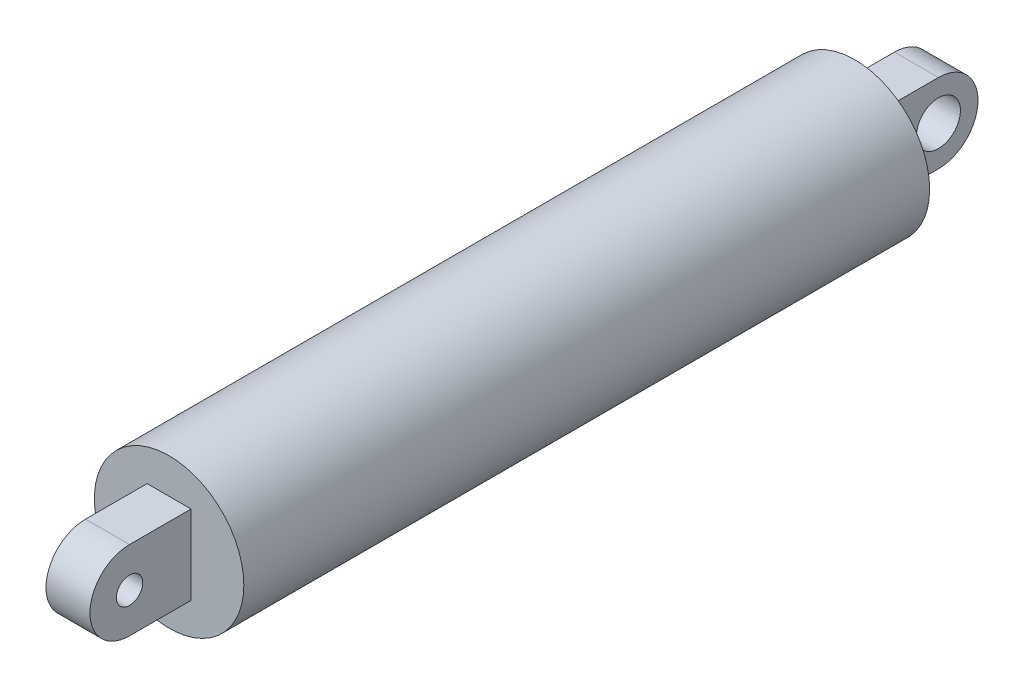
from build123d import *

# Parameters (mm, degrees)
SKETCH1_W           = 78
SKETCH1_H           = 8.5
SKETCH2_R           = 1.5
SKETCH2_R_2         = 2.5
BOSS_EXTRUDE1_DEPTH = 2.5


with BuildPart() as part:
    # Sketch1 → Revolve1 (revolve)
    with BuildSketch(Plane(origin=(0, 0, 0), x_dir=(0, 0, -1), z_dir=(1, 0, 0)), mode=Mode.PRIVATE) as revolve1_sk:
        with Locations((39, 4.25)):
            Rectangle(SKETCH1_W, SKETCH1_H)
    revolve(revolve1_sk.sketch.rotate(Axis((0, 0, 27.669458773), (0, 0, -1)), 90), axis=Axis((0, 0, 27.669458773), (0, 0, -1)))

    # Sketch2 → Boss-Extrude1 (add, symmetric)
    # profile 1 of 2: a face of its own
    with BuildSketch(Plane(origin=(0, 0, 0), x_dir=(0, 0, -1), z_dir=(1, 0, 0))):
        with BuildLine():
            Line((-7, 4.5), (0, 4.5))
            Line((0, 4.5), (0, -4.5))
            Line((0, -4.5), (-7, -4.5))
            ThreePointArc((-7, -4.5), (-11.5, 0), (-7, 4.5))
        make_face()
        with Locations((-7, 0)):
            Circle(SKETCH2_R, mode=Mode.SUBTRACT)
    # profile 2 of 2: a face of its own
    with BuildSketch(Plane(origin=(0, 0, 0), x_dir=(0, 0, -1), z_dir=(1, 0, 0))):
        with BuildLine():
            Line((85, 4.5), (78, 4.5))
            Line((78, 4.5), (78, -4.5))
            Line((78, -4.5), (85, -4.5))
            ThreePointArc((85, -4.5), (89.5, 0), (85, 4.5))
        make_face()
        with Locations((85, 0)):
            Circle(SKETCH2_R_2, mode=Mode.SUBTRACT)
    extrude(amount=BOSS_EXTRUDE1_DEPTH, both=True)


solid = part.part
